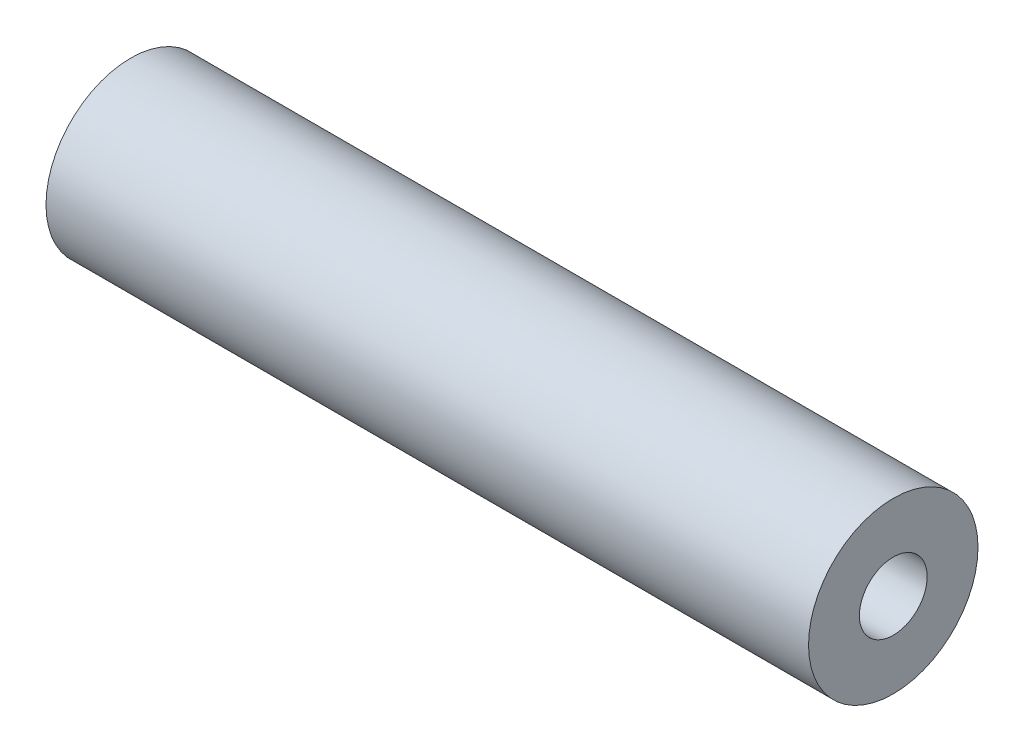
from build123d import *

# Parameters (mm, degrees)
SKETCH_1_W = 90
SKETCH_1_H = 6


with BuildPart() as part:
    # ｽｹｯﾁ1 → 回転1 (revolve)
    with BuildSketch(Plane.XY, mode=Mode.PRIVATE) as revolve_1_sk:
        with Locations((0, 7)):
            Rectangle(SKETCH_1_W, SKETCH_1_H)
    revolve(revolve_1_sk.sketch.rotate(Axis((0, 0, 0), (1, 0, 0)), 90), axis=Axis((0, 0, 0), (1, 0, 0)))


solid = part.part
